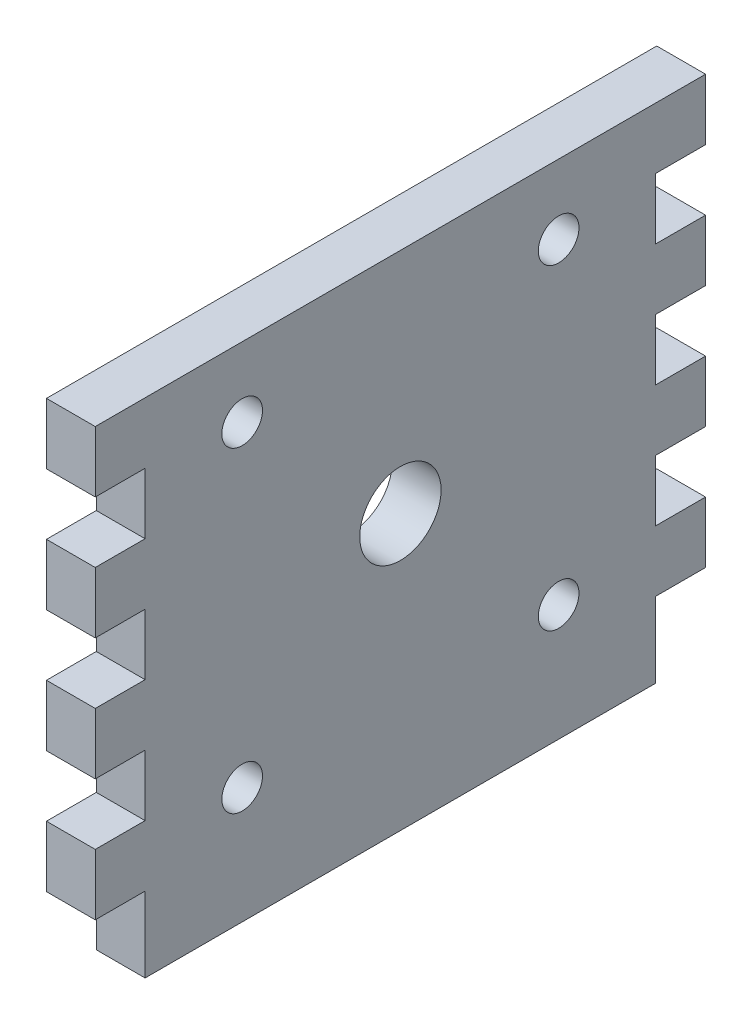
from build123d import *

# Parameters (mm, degrees)
SKETCH1_W               = 76.2
SKETCH1_H               = 62.738
BOSS_EXTRUDE1_DEPTH     = 6.096
SKETCH2_R               = 5.08
SKETCH2_R_2             = 2.54
CUT_EXTRUDE1_DEPTH      = 6.096
SKETCH3_W               = 6.223
SKETCH3_H               = 7.62
CUT_EXTRUDE2_DEPTH      = 6.096
CUT_EXTRUDE3_DEPTH      = 7.874
CUT_EXTRUDE3_DEPTH_BACK = 6.096
SKETCH4_W               = 6.223
SKETCH4_H               = 9.398


with BuildPart() as part:
    # Sketch1 → Boss-Extrude1 (new body)
    with BuildSketch(Plane(origin=(0, 0, 0), x_dir=(0, 0, -1), z_dir=(1, 0, 0))):
        with Locations((1.357482185, -4.852847981)):
            Rectangle(SKETCH1_W, SKETCH1_H)
    extrude(amount=BOSS_EXTRUDE1_DEPTH)

    # Sketch2 → Cut-Extrude1 (cut)
    with BuildSketch(Plane(origin=(6.096, 0, 0), x_dir=(0, 0, -1), z_dir=(1, 0, 0))):
        with Locations((1.357482185, -1.931847981)):
            Circle(SKETCH2_R)
        with Locations((-18.399081281, 17.824715485)):
            Circle(SKETCH2_R_2)
        with Locations((21.114045652, 17.824715485)):
            Circle(SKETCH2_R_2)
        with Locations((21.114045652, -21.688411447)):
            Circle(SKETCH2_R_2)
        with Locations((-18.399081281, -21.688411447)):
            Circle(SKETCH2_R_2)
    extrude(amount=-CUT_EXTRUDE1_DEPTH, mode=Mode.SUBTRACT)

    # Sketch3 → Cut-Extrude2 (cut)
    with BuildSketch(Plane(origin=(6.096, 0, 0), x_dir=(0, 0, -1), z_dir=(1, 0, 0))):
        with Locations((-33.631017815, 15.086152019)):
            Rectangle(SKETCH3_W, SKETCH3_H)
        with Locations((-33.631017815, -0.153847981)):
            Rectangle(SKETCH3_W, SKETCH3_H)
        with Locations((-33.631017815, -15.393847981)):
            Rectangle(SKETCH3_W, SKETCH3_H)
        with Locations((36.345982185, -15.393847981)):
            Rectangle(SKETCH3_W, SKETCH3_H)
        with Locations((36.345982185, 15.086152019)):
            Rectangle(SKETCH3_W, SKETCH3_H)
        with Locations((36.345982185, -0.153847981)):
            Rectangle(SKETCH3_W, SKETCH3_H)
    extrude(amount=-CUT_EXTRUDE2_DEPTH, mode=Mode.SUBTRACT)

    # Sketch4 → Cut-Extrude3 (cut, two sides: drawn at the far end of the back side and taken through both)
    with BuildSketch(Plane(origin=(6.096, 0, 0), x_dir=(0, 0, -1), z_dir=(1, 0, 0)).offset(-CUT_EXTRUDE3_DEPTH_BACK)):
        with Locations((36.345982185, -31.522847981)):
            Rectangle(SKETCH4_W, SKETCH4_H)
        with Locations((-33.631017815, -31.522847981)):
            Rectangle(SKETCH4_W, SKETCH4_H)
    extrude(amount=CUT_EXTRUDE3_DEPTH + CUT_EXTRUDE3_DEPTH_BACK, mode=Mode.SUBTRACT)


solid = part.part
